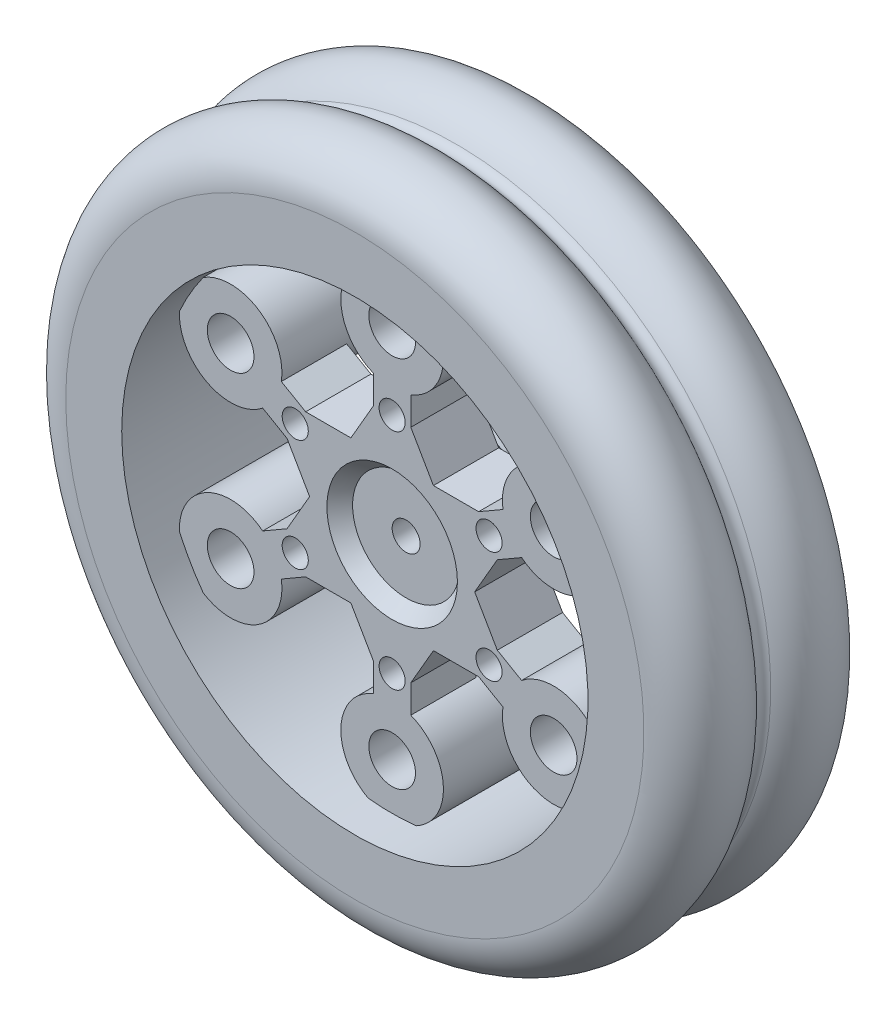
from build123d import *

# Parameters (mm, degrees)
SKETCH_2_R               = 5.5
EXTRUDE_1_DEPTH          = 10
PATTERN_CIRCULAR_1_COUNT = 6
EXTRUDE_2_DEPTH          = 7
SKETCH_4_R               = 1.4
CUT_EXTRUDE_1_DEPTH      = 53.086466711
PATTERN_CIRCULAR_2_COUNT = 6
SKETCH_5_R               = 9
EXTRUDE_3_DEPTH          = 5
SKETCH_7_R               = 7
CUT_EXTRUDE_3_DEPTH      = 1.5
CUT_EXTRUDE_3_DRAFT      = -40
SKETCH_8_R               = 1.5
CUT_EXTRUDE_4_DEPTH      = 53.93628259
SKETCH_10_R              = 1.25
CUT_EXTRUDE_6_DEPTH      = 54.366656391
SKETCH_11_R              = 2.5
CUT_EXTRUDE_7_DEPTH      = 54.366656391
PATTERN_CIRCULAR_4_COUNT = 6
CUT_EXTRUDE_9_DEPTH      = 8


with BuildPart() as part:
    # 草图1 → 旋转1 (revolve)
    with BuildSketch(Plane(origin=(0, 0, 0), x_dir=(1, 0, 0), z_dir=(0, 1, 0)), mode=Mode.PRIVATE) as revolve_1_sk:
        with BuildLine():
            Line((25, 10), (25, -10))
            Line((25, -10), (31, -10))
            ThreePointArc((31, -10), (35.787135539, -6.443375673), (33.763853992, -0.833333333))
            ThreePointArc((33.763853992, -0.833333333), (33.31662479, 0), (33.763853992, 0.833333333))
            ThreePointArc((33.763853992, 0.833333333), (35.787135539, 6.443375673), (31, 10))
            Line((31, 10), (25, 10))
        make_face()
    revolve(revolve_1_sk.sketch.rotate(Axis((0, 0, -146.934042126), (0, 0, 1)), 180), axis=Axis((0, 0, -146.934042126), (0, 0, 1)))

    # 草图2 → 凸台-拉伸1 (add)
    with BuildSketch(Plane.XY.offset(6)):
        with Locations((0, 20)):
            Circle(SKETCH_2_R)
    extrude_1 = extrude(amount=-EXTRUDE_1_DEPTH)

    # 阵列(圆周)1: 凸台-拉伸1 ×6 about axis
    pattern_circular_1_axis = Axis((0, 0, 0), (0, 0, 1))
    for i in range(1, PATTERN_CIRCULAR_1_COUNT):
        add(extrude_1.rotate(pattern_circular_1_axis, i * 360 / PATTERN_CIRCULAR_1_COUNT))

    # 草图3 → 凸台-拉伸2 (add)
    with BuildSketch(Plane.XY.offset(6)):
        with BuildLine():
            Line((-8.849844437, 0), (-11.274766656, -4.200088487))
            Line((-11.274766656, -4.200088487), (-13.883448238, -5.706211501))
            ThreePointArc((-13.883448238, -5.706211501), (-12.557368355, -7.25), (-11.883448238, -9.170313116))
            Line((-11.883448238, -9.170313116), (-9.274766656, -7.664190102))
            Line((-9.274766656, -7.664190102), (-4.424922219, -7.664190102))
            Line((-4.424922219, -7.664190102), (-2, -11.864278589))
            Line((-2, -11.864278589), (-2, -14.876524617))
            ThreePointArc((-2, -14.876524617), (0, -14.5), (2, -14.876524617))
            Line((2, -14.876524617), (2, -11.864278589))
            Line((2, -11.864278589), (4.424922219, -7.664190102))
            Line((4.424922219, -7.664190102), (9.274766656, -7.664190102))
            Line((9.274766656, -7.664190102), (11.883448238, -9.170313116))
            ThreePointArc((11.883448238, -9.170313116), (12.557368355, -7.25), (13.883448238, -5.706211501))
            Line((13.883448238, -5.706211501), (11.274766656, -4.200088487))
            Line((11.274766656, -4.200088487), (8.849844437, 0))
            Line((8.849844437, 0), (11.274766656, 4.200088487))
            Line((11.274766656, 4.200088487), (13.883448238, 5.706211501))
            ThreePointArc((13.883448238, 5.706211501), (12.557368355, 7.25), (11.883448238, 9.170313116))
            Line((11.883448238, 9.170313116), (9.274766656, 7.664190102))
            Line((9.274766656, 7.664190102), (4.424922219, 7.664190102))
            Line((4.424922219, 7.664190102), (2, 11.864278589))
            Line((2, 11.864278589), (2, 14.876524617))
            ThreePointArc((2, 14.876524617), (0, 14.5), (-2, 14.876524617))
            Line((-2, 14.876524617), (-2, 11.864278589))
            Line((-2, 11.864278589), (-4.424922219, 7.664190102))
            Line((-4.424922219, 7.664190102), (-9.274766656, 7.664190102))
            Line((-9.274766656, 7.664190102), (-11.883448238, 9.170313116))
            ThreePointArc((-11.883448238, 9.170313116), (-12.557368355, 7.25), (-13.883448238, 5.706211501))
            Line((-13.883448238, 5.706211501), (-11.274766656, 4.200088487))
            Line((-11.274766656, 4.200088487), (-8.849844437, 0))
        make_face()
    extrude(amount=-EXTRUDE_2_DEPTH)

    # 草图4 → 切除-拉伸1 (cut, through all)
    with BuildSketch(Plane(origin=(0, 0, -1), x_dir=(-1, 0, 0), z_dir=(0, 0, -1))):
        with Locations((0, 12)):
            Circle(SKETCH_4_R)
    cut_extrude_1 = extrude(amount=-CUT_EXTRUDE_1_DEPTH, mode=Mode.SUBTRACT)

    # 阵列(圆周)2: 切除-拉伸1 ×6 about axis
    pattern_circular_2_axis = Axis((0, 0, 0), (0, 0, 1))
    for i in range(1, PATTERN_CIRCULAR_2_COUNT):
        add(cut_extrude_1.rotate(pattern_circular_2_axis, i * 360 / PATTERN_CIRCULAR_2_COUNT), mode=Mode.SUBTRACT)

    # 草图5 → 凸台-拉伸3 (add)
    with BuildSketch(Plane(origin=(0, 0, -1), x_dir=(-1, 0, 0), z_dir=(0, 0, -1))):
        with Locations(Location((0, 0, 0), (0, 0, 181.616426084))):
            Circle(SKETCH_5_R)
    extrude(amount=EXTRUDE_3_DEPTH)


with BuildPart() as cut_extrude_3_tool:
    # 草图7 → 切除-拉伸3 (with draft: the straight prism first)
    with BuildSketch(Plane.XY.offset(6)):
        Circle(SKETCH_7_R)
    extrude(amount=-CUT_EXTRUDE_3_DEPTH)
    # 切除-拉伸3: the draft: its side faces are tilted about the plane it starts from
    cut_extrude_3_sides = [cut_extrude_3_tool.faces().sort_by_distance(p)[0] for p in [
        (-7, 0, 5.25),
    ]]
    draft(cut_extrude_3_sides, Plane.XY.offset(6), CUT_EXTRUDE_3_DRAFT)


with BuildPart() as part_1:
    add(part.part)

    # 切除-拉伸3: cut by cut_extrude_3_tool
    add(cut_extrude_3_tool.part, mode=Mode.SUBTRACT)

    # 草图8 → 切除-拉伸4 (cut, through all)
    with BuildSketch(Plane.XY.offset(4.5)):
        Circle(SKETCH_8_R)
    extrude(amount=-CUT_EXTRUDE_4_DEPTH, mode=Mode.SUBTRACT)

    # 草图10 → 切除-拉伸6 (cut, through all)
    with BuildSketch(Plane.XY.offset(6)):
        with Locations((0, 20)):
            Circle(SKETCH_10_R)
    extrude(amount=-CUT_EXTRUDE_6_DEPTH, mode=Mode.SUBTRACT)

    # 草图11 → 切除-拉伸7 (cut, through all)
    with BuildSketch(Plane.XY.offset(6)):
        with Locations((0, 20)):
            Circle(SKETCH_11_R)
    cut_extrude_7 = extrude(amount=-CUT_EXTRUDE_7_DEPTH, mode=Mode.SUBTRACT)

    # 阵列(圆周)4: 切除-拉伸7 ×6 about axis
    pattern_circular_4_axis = Axis((0, 0, 0), (0, 0, 1))
    for i in range(1, PATTERN_CIRCULAR_4_COUNT):
        add(cut_extrude_7.rotate(pattern_circular_4_axis, i * 360 / PATTERN_CIRCULAR_4_COUNT), mode=Mode.SUBTRACT)

    # 草图14 → 切除-拉伸9 (cut)
    with BuildSketch(Plane(origin=(0, 0, -6), x_dir=(-1, 0, 0), z_dir=(0, 0, -1))):
        Polygon((0, 6.92820323), (-6, 3.464101615), (-6, -3.464101615), (0, -6.92820323), (6, -3.464101615), (6, 3.464101615), align=None)
    extrude(amount=-CUT_EXTRUDE_9_DEPTH, mode=Mode.SUBTRACT)


solid = part_1.part
